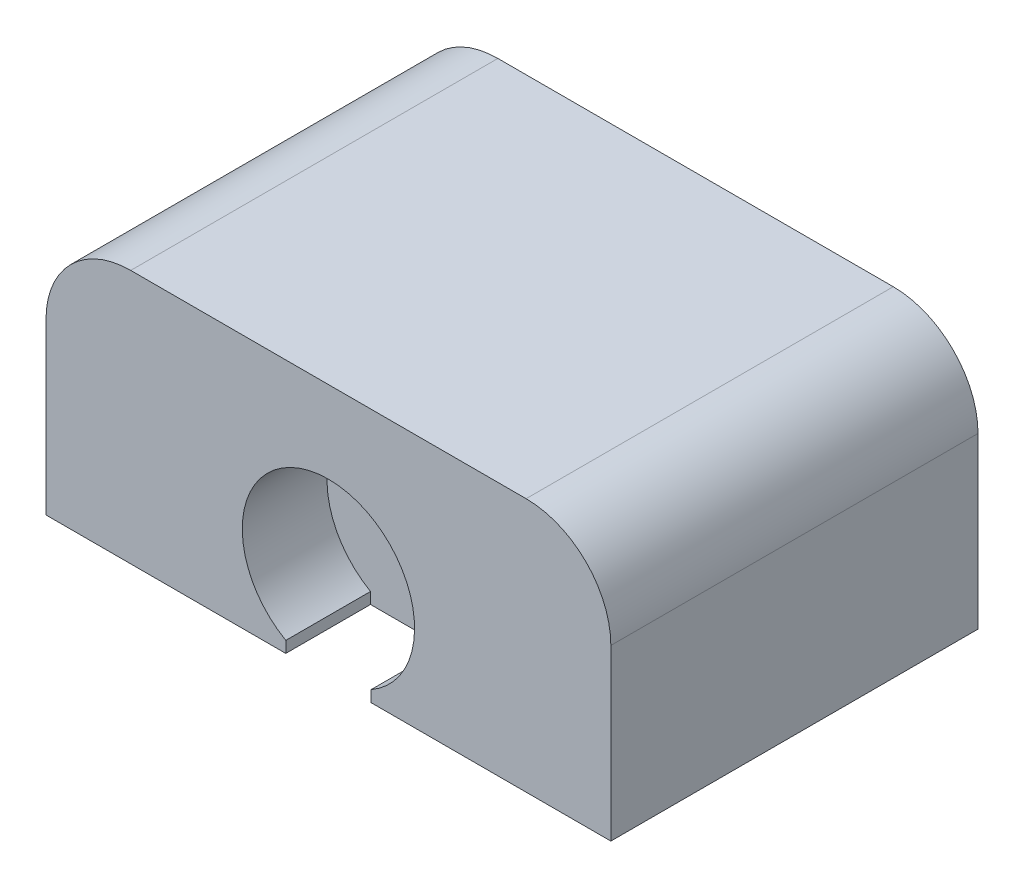
from build123d import *

# Parameters (mm, degrees)
SKETCH1_W           = 20
SKETCH1_H           = 9
BOSS_EXTRUDE1_DEPTH = 13
CUT_EXTRUDE1_DEPTH  = 3
FILLET1_R           = 3


with BuildPart() as part:
    # Sketch1 → Boss-Extrude1 (new body)
    with BuildSketch(Plane.XY):
        Rectangle(SKETCH1_W, SKETCH1_H)
    extrude(amount=BOSS_EXTRUDE1_DEPTH)

    # Sketch2 → Cut-Extrude1 (cut)
    with BuildSketch(Plane.XY.offset(13)):
        with BuildLine():
            Line((1.51, -4.5), (1.51, -4.099981132))
            ThreePointArc((1.51, -4.099981132), (0, 1.6), (-1.51, -4.099981132))
            Line((-1.51, -4.099981132), (-1.51, -4.5))
            Line((-1.51, -4.5), (1.51, -4.5))
        make_face()
    extrude(amount=-CUT_EXTRUDE1_DEPTH, mode=Mode.SUBTRACT)

    # Fillet1
    fillet1_edges = [part.edges().sort_by_distance(p)[0] for p in [
        (-10, 4.5, 6.5),
        (10, 4.5, 6.5),
    ]]
    fillet(fillet1_edges, radius=FILLET1_R)


solid = part.part
